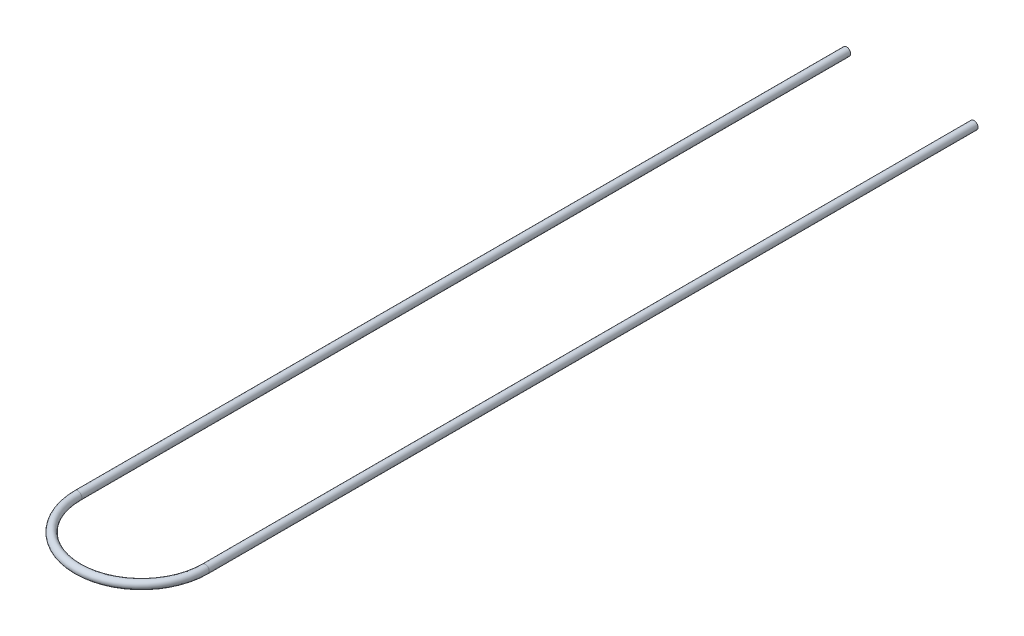
from build123d import *

# Parameters (mm, degrees)
SKETCH2_R   = 11.1
SKETCH2_R_2 = 9.95


with BuildPart() as part:
    # Sweep1: sweep along a path in Sketch1
    with BuildLine(Plane(origin=(0, 0, 0), x_dir=(1, 0, 0), z_dir=(0, 1, 0))) as sweep1_path:
        Line((314.7, -300), (314.7, -2440))
        ThreePointArc((314.7, -2440), (137.35, -2617.35), (-40, -2440))
        Line((-40, -2440), (-40, -300))
    # Sketch2 → Sweep1 (sweep)
    with BuildSketch(Plane(origin=(314.7, 0, 300), x_dir=(-1, 0, 0), z_dir=(0, 0, -1))):
        Circle(SKETCH2_R)
        Circle(SKETCH2_R_2, mode=Mode.SUBTRACT)
    sweep(path=sweep1_path.line)


solid = part.part
